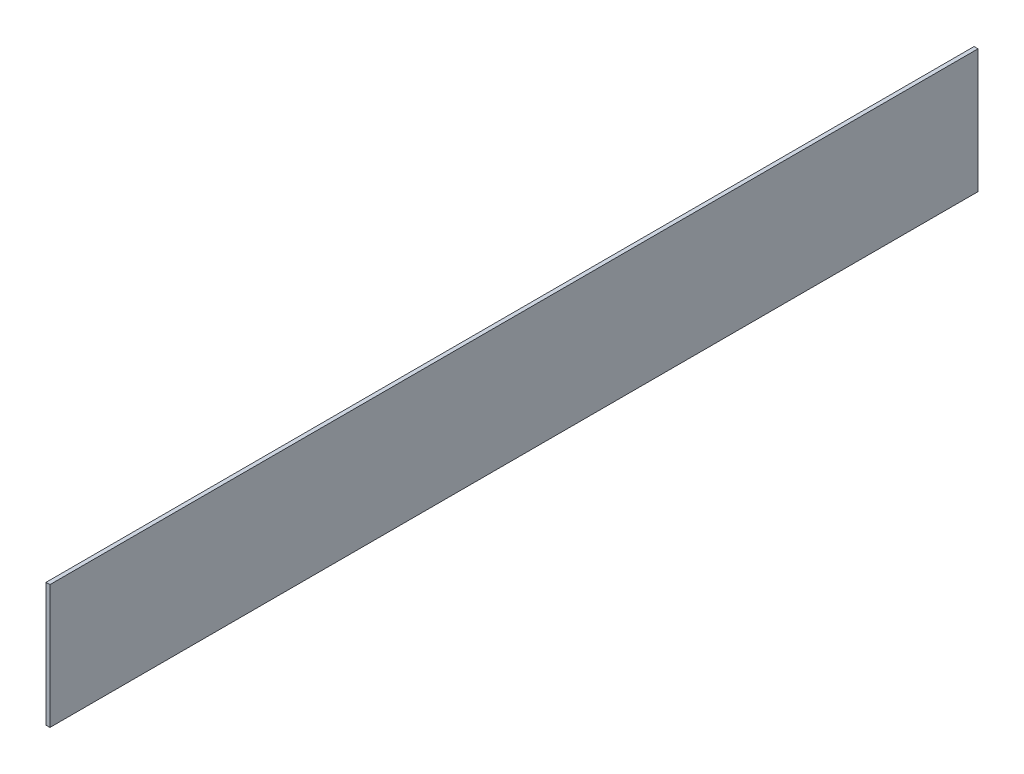
from build123d import *

# Parameters (mm, degrees)
SKETCH1_W           = 1500
SKETCH1_H           = 200
BOSS_EXTRUDE1_DEPTH = 3.175


with BuildPart() as part:
    # Sketch1 → Boss-Extrude1 (new, symmetric)
    with BuildSketch(Plane(origin=(0, 0, 0), x_dir=(0, 0, -1), z_dir=(1, 0, 0))):
        Rectangle(SKETCH1_W, SKETCH1_H)
    extrude(amount=BOSS_EXTRUDE1_DEPTH, both=True)


solid = part.part
